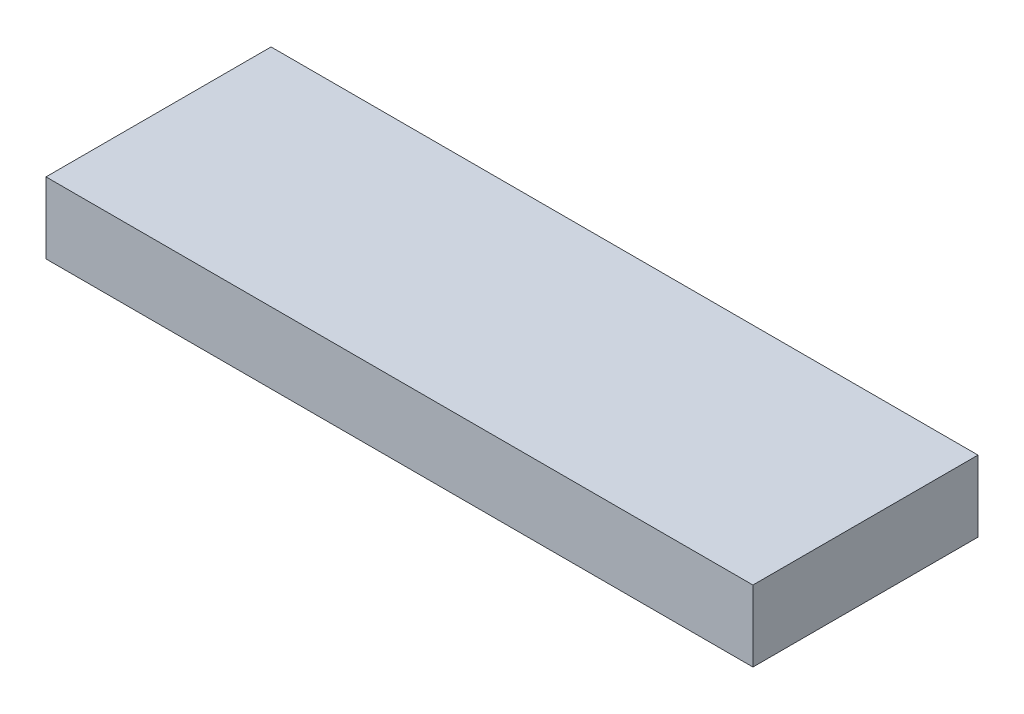
from build123d import *

# Parameters (mm, degrees)
SKETCH1_W           = 189.477532672
SKETCH1_H           = 19.05
BOSS_EXTRUDE1_DEPTH = 60.325
HOLE1_D             = 3.175
HOLE1_DEPTH         = 38.1
HOLE1_CSINK_D       = 10.16
HOLE1_CSINK_ANGLE   = 82
HOLE1_TIP           = 0.953866233


with BuildPart() as part:
    # Sketch1 → Boss-Extrude1 (new body)
    with BuildSketch(Plane.XY):
        with Locations((228.6, -9.525)):
            Rectangle(SKETCH1_W, SKETCH1_H)
    extrude(amount=BOSS_EXTRUDE1_DEPTH)

    # Hole1
    with Locations(Plane(origin=(228.6, 0, -25.4), x_dir=(-1, 0, 0), z_dir=(0, 0, -1))):
        with Locations((-75.688766336, -9.525), (218.563766336, -31.75), (218.563766336, -218.821), (218.563766336, -418.592), (104.263766336, -19.05), (104.263766336, -149.225), (104.263766336, -279.4), (120.138766336, -330.2), (120.138766336, -441.325), (-120.138766336, -441.325), (-120.138766336, -330.2), (-104.263766336, -279.4), (-104.263766336, -149.225), (-104.263766336, -19.05), (-218.563766336, -418.592), (-218.563766336, -218.821), (-218.563766336, -31.75), (0, -304.8), (107.438766336, -304.8), (-107.438766336, -304.8), (75.688766336, -276.225), (0, -276.225), (-75.688766336, -276.225), (75.688766336, -9.525), (0, -9.525)):
            CounterSinkHole(HOLE1_D / 2, HOLE1_CSINK_D / 2, depth=HOLE1_DEPTH, counter_sink_angle=HOLE1_CSINK_ANGLE)
            with Locations((0, 0, -(HOLE1_DEPTH + HOLE1_TIP / 2))):  # 118° drill point
                Cone(0, HOLE1_D / 2, HOLE1_TIP, mode=Mode.SUBTRACT)


solid = part.part
